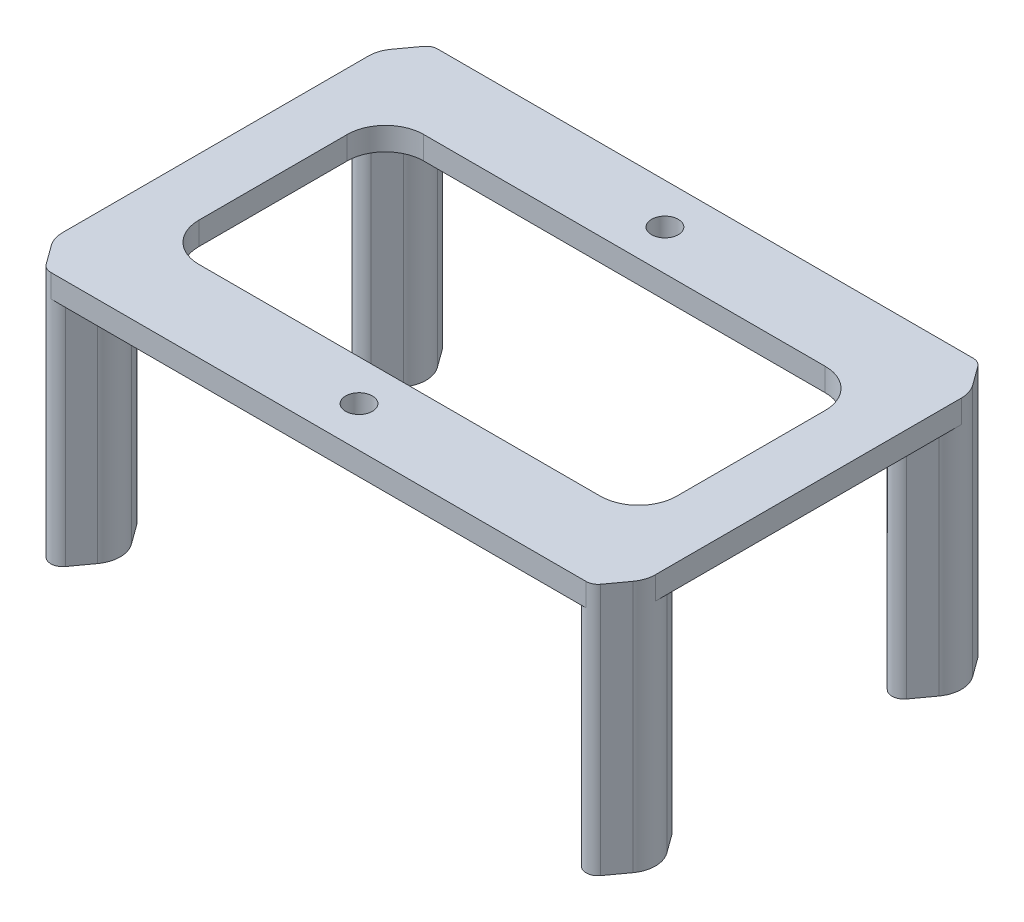
from build123d import *

# Parameters (mm, degrees)
SKETCH1_R             = 1.6
BOSS_EXTRUDE1_DEPTH   = 30
BOSS_EXTRUDE1_2_DEPTH = 30
BOSS_EXTRUDE1_3_DEPTH = 30
BOSS_EXTRUDE1_4_DEPTH = 30
BOSS_EXTRUDE2_DEPTH   = 3
SKETCH3_R             = 1.75
CUT_EXTRUDE1_DEPTH    = 3


with BuildPart() as part:
    # Sketch1 → Boss-Extrude1 (new body)
    with BuildSketch(Plane(origin=(0, 0, 0), x_dir=(1, 0, 0), z_dir=(0, 1, 0))):
        with BuildLine():
            Line((-1.25, 4.658509183), (-3.033431688, 2.204720435))
            ThreePointArc((-3.033431688, 2.204720435), (-3.75, 0), (-3.033431688, -2.204720435))
            Line((-3.033431688, -2.204720435), (-1.25, -4.658509183))
            ThreePointArc((-1.25, -4.658509183), (0, -5.295279565), (1.25, -4.658509183))
            Line((1.25, -4.658509183), (3.033431688, -2.204720435))
            ThreePointArc((3.033431688, -2.204720435), (3.75, 0), (3.033431688, 2.204720435))
            Line((3.033431688, 2.204720435), (1.25, 4.658509183))
            ThreePointArc((1.25, 4.658509183), (0, 5.295279565), (-1.25, 4.658509183))
        make_face()
        with Locations(Location((0, 0, 0), (0, 0, 270))):
            Circle(SKETCH1_R, mode=Mode.SUBTRACT)
    extrude(amount=BOSS_EXTRUDE1_DEPTH)



with BuildPart() as body_2:
    # Sketch1 → Boss-Extrude1 2 (new body)
    with BuildSketch(Plane(origin=(0, 0, 0), x_dir=(1, 0, 0), z_dir=(0, 1, 0))):
        with BuildLine():
            Line((68.75, 4.658509183), (66.966568312, 2.204720435))
            ThreePointArc((66.966568312, 2.204720435), (66.25, 0), (66.966568312, -2.204720435))
            Line((66.966568312, -2.204720435), (68.75, -4.658509183))
            ThreePointArc((68.75, -4.658509183), (70, -5.295279565), (71.25, -4.658509183))
            Line((71.25, -4.658509183), (73.033431688, -2.204720435))
            ThreePointArc((73.033431688, -2.204720435), (73.75, 0), (73.033431688, 2.204720435))
            Line((73.033431688, 2.204720435), (71.25, 4.658509183))
            ThreePointArc((71.25, 4.658509183), (70, 5.295279565), (68.75, 4.658509183))
        make_face()
        with Locations(Location((70, 0, 0), (0, 0, 270))):
            Circle(SKETCH1_R, mode=Mode.SUBTRACT)
    extrude(amount=BOSS_EXTRUDE1_2_DEPTH)


with BuildPart() as body_3:
    # Sketch1 → Boss-Extrude1 3 (new body)
    with BuildSketch(Plane(origin=(0, 0, 0), x_dir=(1, 0, 0), z_dir=(0, 1, 0))):
        with BuildLine():
            Line((68.75, -35.341490817), (66.966568312, -37.795279565))
            ThreePointArc((66.966568312, -37.795279565), (66.25, -40), (66.966568312, -42.204720435))
            Line((66.966568312, -42.204720435), (68.75, -44.658509183))
            ThreePointArc((68.75, -44.658509183), (70, -45.295279565), (71.25, -44.658509183))
            Line((71.25, -44.658509183), (73.033431688, -42.204720435))
            ThreePointArc((73.033431688, -42.204720435), (73.75, -40), (73.033431688, -37.795279565))
            Line((73.033431688, -37.795279565), (71.25, -35.341490817))
            ThreePointArc((71.25, -35.341490817), (70, -34.704720435), (68.75, -35.341490817))
        make_face()
        with Locations(Location((70, -40, 0), (0, 0, 270))):
            Circle(SKETCH1_R, mode=Mode.SUBTRACT)
    extrude(amount=BOSS_EXTRUDE1_3_DEPTH)


with BuildPart() as body_4:
    # Sketch1 → Boss-Extrude1 4 (new body)
    with BuildSketch(Plane(origin=(0, 0, 0), x_dir=(1, 0, 0), z_dir=(0, 1, 0))):
        with BuildLine():
            Line((-1.25, -35.341490817), (-3.033431688, -37.795279565))
            ThreePointArc((-3.033431688, -37.795279565), (-3.75, -40), (-3.033431688, -42.204720435))
            Line((-3.033431688, -42.204720435), (-1.25, -44.658509183))
            ThreePointArc((-1.25, -44.658509183), (0, -45.295279565), (1.25, -44.658509183))
            Line((1.25, -44.658509183), (3.033431688, -42.204720435))
            ThreePointArc((3.033431688, -42.204720435), (3.75, -40), (3.033431688, -37.795279565))
            Line((3.033431688, -37.795279565), (1.25, -35.341490817))
            ThreePointArc((1.25, -35.341490817), (0, -34.704720435), (-1.25, -35.341490817))
        make_face()
        with Locations(Location((0, -40, 0), (0, 0, 270))):
            Circle(SKETCH1_R, mode=Mode.SUBTRACT)
    extrude(amount=BOSS_EXTRUDE1_4_DEPTH)


with BuildPart() as part_1:
    add(part.part)

    add(body_2.part)  # Boss-Extrude2 merges body 2

    add(body_3.part)  # Boss-Extrude2 merges body 3

    add(body_4.part)  # Boss-Extrude2 merges body 4
    # Sketch2 → Boss-Extrude2 (add)
    with BuildSketch(Plane(origin=(0, 30, 0), x_dir=(1, 0, 0), z_dir=(0, 1, 0))):
        with BuildLine():
            Line((-3.75, 0), (-3.75, -40))
            ThreePointArc((-3.75, -40), (-3.566361509, -41.159122765), (-3.033431688, -42.204720435))
            Line((-3.033431688, -42.204720435), (-1.25, -44.658509183))
            ThreePointArc((-1.25, -44.658509183), (-0.701422932, -45.126914959), (0, -45.295279565))
            Line((0, -45.295279565), (70, -45.295279565))
            ThreePointArc((70, -45.295279565), (70.701422932, -45.126914959), (71.25, -44.658509183))
            Line((71.25, -44.658509183), (73.033431688, -42.204720435))
            ThreePointArc((73.033431688, -42.204720435), (73.566361509, -41.159122765), (73.75, -40))
            Line((73.75, -40), (73.75, 0))
            ThreePointArc((73.75, 0), (73.566361509, 1.159122765), (73.033431688, 2.204720435))
            Line((73.033431688, 2.204720435), (71.25, 4.658509183))
            ThreePointArc((71.25, 4.658509183), (70.701422932, 5.126914959), (70, 5.295279565))
            Line((70, 5.295279565), (0, 5.295279565))
            ThreePointArc((0, 5.295279565), (-0.701422932, 5.126914959), (-1.25, 4.658509183))
            Line((-1.25, 4.658509183), (-3.033431688, 2.204720435))
            ThreePointArc((-3.033431688, 2.204720435), (-3.566361509, 1.159122765), (-3.75, 0))
        make_face()
        with BuildLine():
            Line((8.75, -34.704720435), (61.25, -34.704720435))
            ThreePointArc((61.25, -34.704720435), (64.785533906, -33.240254341), (66.25, -29.704720435))
            Line((66.25, -29.704720435), (66.25, -10.295279565))
            ThreePointArc((66.25, -10.295279565), (64.785533906, -6.759745659), (61.25, -5.295279565))
            Line((61.25, -5.295279565), (8.75, -5.295279565))
            ThreePointArc((8.75, -5.295279565), (5.214466094, -6.759745659), (3.75, -10.295279565))
            Line((3.75, -10.295279565), (3.75, -29.704720435))
            ThreePointArc((3.75, -29.704720435), (5.214466094, -33.240254341), (8.75, -34.704720435))
        make_face(mode=Mode.SUBTRACT)
    extrude(amount=BOSS_EXTRUDE2_DEPTH)

    # Sketch3 → Cut-Extrude1 (cut)
    with BuildSketch(Plane(origin=(0, 33, 0), x_dir=(1, 0, 0), z_dir=(0, 1, 0))):
        with Locations(Location((35, -0.004720435, 0), (0, 0, 270))):
            Circle(SKETCH3_R)
        with Locations(Location((35, -40.004720435, 0), (0, 0, 270))):
            Circle(SKETCH3_R)
    extrude(amount=-CUT_EXTRUDE1_DEPTH, mode=Mode.SUBTRACT)


solid = part_1.part
